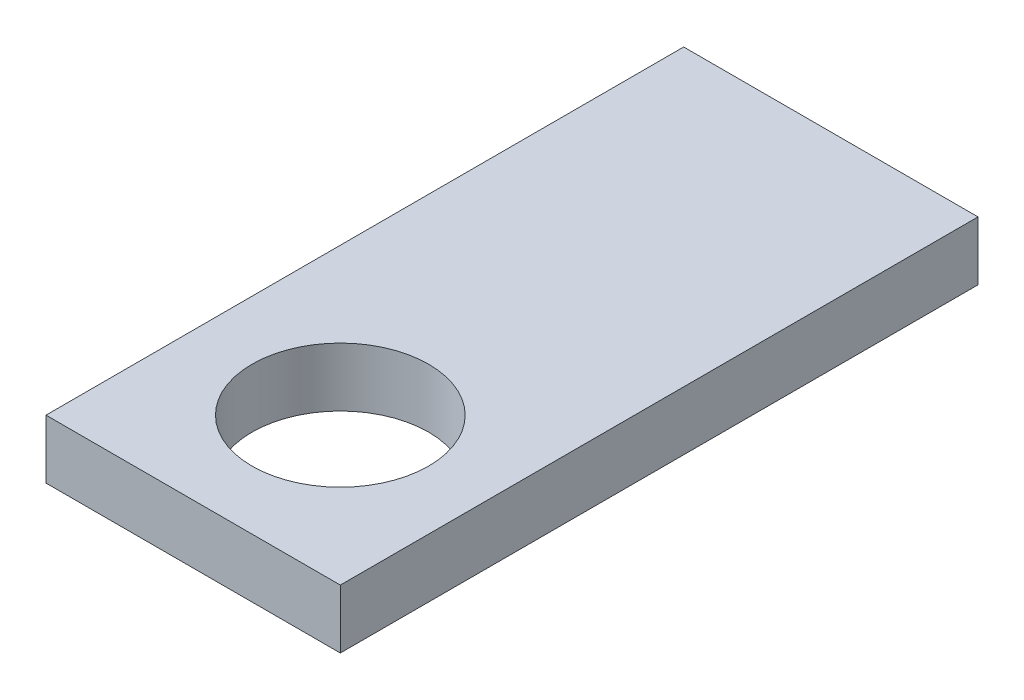
from build123d import *

# Parameters (mm, degrees)
SKETCH_1_W      = 7.5
SKETCH_1_H      = 17.5
EXTRUDE_2_DEPTH = 3


with BuildPart() as part:
    # 草图1 → 凸台-拉伸2 (new body)
    # profile 1 of 3: a face of its own
    with BuildSketch(Plane(origin=(0, 0, 0), x_dir=(1, 0, 0), z_dir=(0, 1, 0))):
        Polygon((7.5, 7.5), (0, 7.5), (-7.5, 7.5), (-7.5, -7.5), (7.5, -7.5), align=None)
        with BuildLine():
            ThreePointArc((4.5, 0), (-3.181980515, -3.181980515), (0, 4.5))
            ThreePointArc((0, 4.5), (3.181980515, 3.181980515), (4.5, 0))
        make_face(mode=Mode.SUBTRACT)
    # profile 2 of 3: a face of its own
    with BuildSketch(Plane(origin=(0, 0, 0), x_dir=(1, 0, 0), z_dir=(0, 1, 0))):
        with Locations((-3.75, 16.25)):
            Rectangle(SKETCH_1_W, SKETCH_1_H)
    # profile 3 of 3: a face of its own
    with BuildSketch(Plane(origin=(0, 0, 0), x_dir=(1, 0, 0), z_dir=(0, 1, 0))):
        with Locations((3.75, 16.25)):
            Rectangle(SKETCH_1_W, SKETCH_1_H)
    extrude(amount=EXTRUDE_2_DEPTH)


solid = part.part
